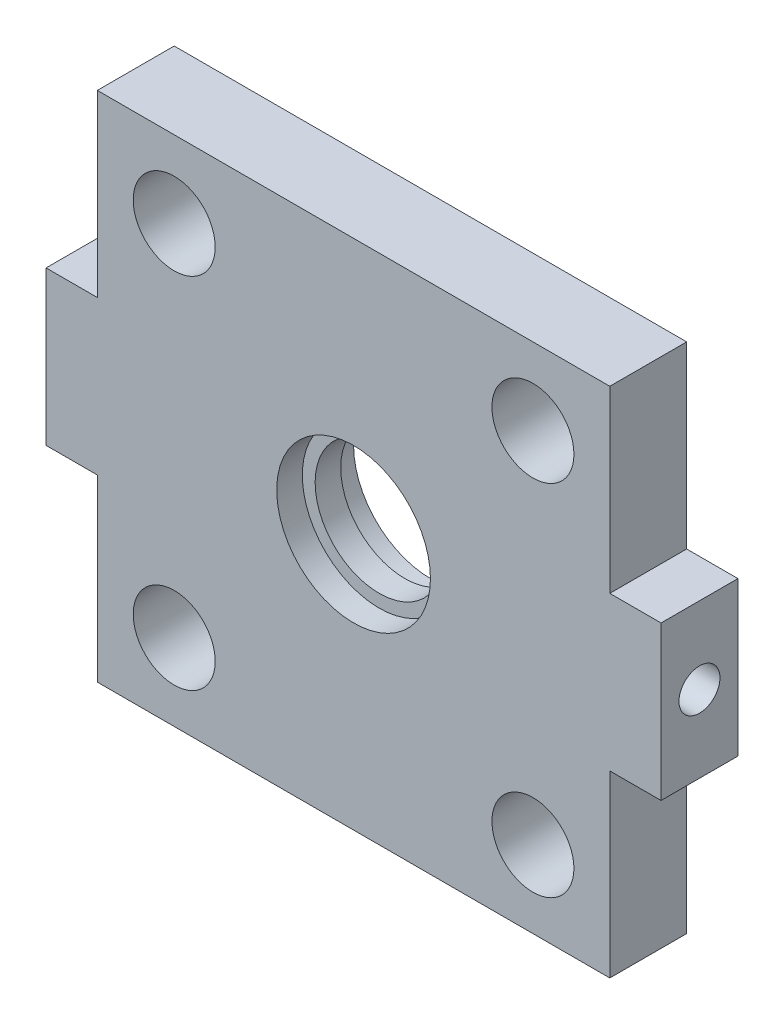
from build123d import *

# Parameters (mm, degrees)
SKETCH1_W           = 100
SKETCH1_H           = 100
SKETCH1_R           = 8
BOSS_EXTRUDE1_DEPTH = 15
SKETCH4_W           = 15
SKETCH4_H           = 30
BOSS_EXTRUDE2_DEPTH = 10
SKETCH7_W           = 15
SKETCH7_H           = 30
BOSS_EXTRUDE3_DEPTH = 10
SKETCH8_R           = 15
CUT_EXTRUDE1_DEPTH  = 5
CUT_EXTRUDE2_START  = -5
SKETCH10_R          = 15
CUT_EXTRUDE2_DEPTH  = 5
SKETCH11_R          = 12.5
CUT_EXTRUDE5_DEPTH  = 150.415527975
SKETCH12_R          = 4
CUT_EXTRUDE6_DEPTH  = 20
CUT_EXTRUDE7_START  = -20
SKETCH13_R          = 4
CUT_EXTRUDE7_DEPTH  = 20


with BuildPart() as part:
    # Sketch1 → Boss-Extrude1 (new body)
    with BuildSketch(Plane.XY):
        with Locations((50, 50)):
            Rectangle(SKETCH1_W, SKETCH1_H)
        with Locations((15, 85)):
            Circle(SKETCH1_R, mode=Mode.SUBTRACT)
        with Locations((85, 85)):
            Circle(SKETCH1_R, mode=Mode.SUBTRACT)
        with Locations((85, 15)):
            Circle(SKETCH1_R, mode=Mode.SUBTRACT)
        with Locations((15, 15)):
            Circle(SKETCH1_R, mode=Mode.SUBTRACT)
    extrude(amount=BOSS_EXTRUDE1_DEPTH)

    # Sketch4 → Boss-Extrude2 (add)
    with BuildSketch(Plane(origin=(100, 0, 0), x_dir=(0, 0, -1), z_dir=(1, 0, 0))):
        with Locations((-7.5, 50)):
            Rectangle(SKETCH4_W, SKETCH4_H)
    extrude(amount=BOSS_EXTRUDE2_DEPTH)

    # Sketch7 → Boss-Extrude3 (add)
    with BuildSketch(Plane.ZY):
        with Locations((7.5, 50)):
            Rectangle(SKETCH7_W, SKETCH7_H)
    extrude(amount=BOSS_EXTRUDE3_DEPTH)

    # Sketch8 → Cut-Extrude1 (cut)
    with BuildSketch(Plane.XY.offset(15)):
        with Locations((50, 50)):
            Circle(SKETCH8_R)
    extrude(amount=-CUT_EXTRUDE1_DEPTH, mode=Mode.SUBTRACT)

    # Sketch10 → Cut-Extrude2 (cut)
    with BuildSketch(Plane(origin=(0, 0, 0), x_dir=(-1, 0, 0), z_dir=(0, 0, -1)).offset(CUT_EXTRUDE2_START)):
        with Locations(Location((-50, 50, 0), (0, 0, 180))):
            Circle(SKETCH10_R)
    extrude(amount=CUT_EXTRUDE2_DEPTH, mode=Mode.SUBTRACT)

    # Sketch11 → Cut-Extrude5 (cut, through all)
    with BuildSketch(Plane(origin=(0, 0, 0), x_dir=(-1, 0, 0), z_dir=(0, 0, -1))):
        with Locations((-50, 50)):
            Circle(SKETCH11_R)
    extrude(amount=-CUT_EXTRUDE5_DEPTH, mode=Mode.SUBTRACT)

    # Sketch12 → Cut-Extrude6 (cut)
    with BuildSketch(Plane(origin=(110, 0, 0), x_dir=(0, 0, -1), z_dir=(1, 0, 0))):
        with Locations((-7.5, 50)):
            Circle(SKETCH12_R)
    extrude(amount=-CUT_EXTRUDE6_DEPTH, mode=Mode.SUBTRACT)

    # Sketch13 → Cut-Extrude7 (cut)
    with BuildSketch(Plane.ZY.offset(10).offset(CUT_EXTRUDE7_START)):
        with Locations(Location((7.5, 50, 0), (0, 0, 180))):
            Circle(SKETCH13_R)
    extrude(amount=CUT_EXTRUDE7_DEPTH, mode=Mode.SUBTRACT)


solid = part.part
